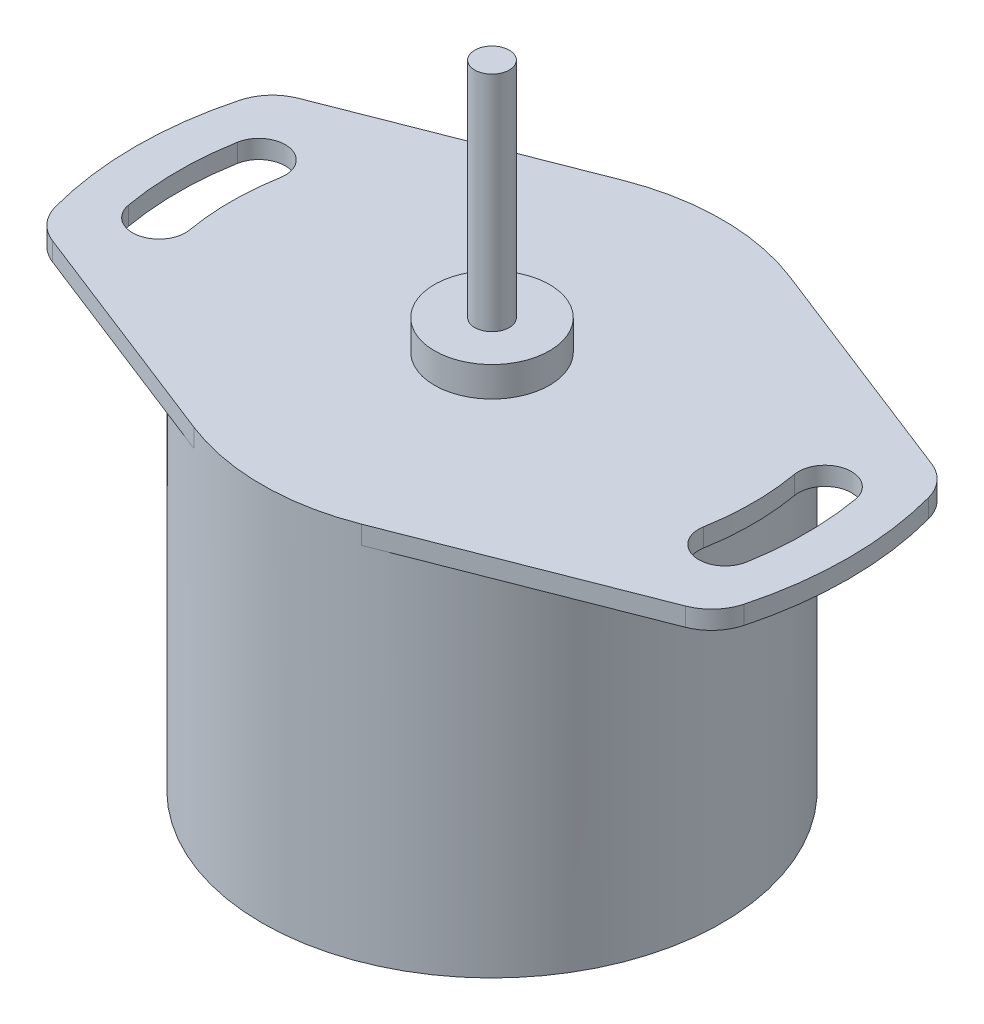
from build123d import *
from build123d.topology import SkipClean

# Parameters (mm, degrees)
SKETCH1_R           = 10
BOSS_EXTRUDE1_DEPTH = 15.7
SKETCH2_R           = 3
BOSS_EXTRUDE2_DEPTH = 1.3
BOSS_EXTRUDE3_DEPTH = 0.8
FILLET1_R           = 2
SKETCH4_R           = 2.5
BOSS_EXTRUDE4_DEPTH = 1.3
SKETCH5_R           = 0.75
BOSS_EXTRUDE5_DEPTH = 9.7
BOSS_EXTRUDE6_START = 1.2
SKETCH6_R           = 0.75
BOSS_EXTRUDE6_DEPTH = 1.2


with BuildPart() as part:
    # Sketch1 → Boss-Extrude1 (new body)
    with BuildSketch(Plane(origin=(0, 0, 0), x_dir=(1, 0, 0), z_dir=(0, 1, 0))):
        with Locations(Location((0, 0, 0), (0, 0, 270))):
            Circle(SKETCH1_R)
    extrude(amount=BOSS_EXTRUDE1_DEPTH)

    # Sketch2 → Boss-Extrude2 (add)
    with BuildSketch(Plane.XZ):
        with Locations(Location((0, 0, 0), (0, 0, 90))):
            Circle(SKETCH2_R)
    extrude(amount=BOSS_EXTRUDE2_DEPTH)

    # Sketch3 → Boss-Extrude3 (add)
    with SkipClean():  # the faces are left unmerged after this step: merging them gives an invalid solid
        with BuildSketch(Plane(origin=(0, 15.7, 0), x_dir=(1, 0, 0), z_dir=(0, 1, 0))):
            with BuildLine():
                Line((-14.671400751, 5), (-3.642056653, 9.313185456))
                ThreePointArc((-3.642056653, 9.313185456), (0, 10), (3.642056653, 9.313185456))
                Line((3.642056653, 9.313185456), (14.671400751, 5))
                ThreePointArc((14.671400751, 5), (15.5, 0), (14.671400751, -5))
                Line((14.671400751, -5), (3.642056653, -9.313185456))
                ThreePointArc((3.642056653, -9.313185456), (0, -10), (-3.642056653, -9.313185456))
                Line((-3.642056653, -9.313185456), (-14.671400751, -5))
                ThreePointArc((-14.671400751, -5), (-15.5, 0), (-14.671400751, 5))
            make_face()
            with BuildLine():
                ThreePointArc((-13.442625829, 2.370297625), (-13.65, 0), (-13.442625829, -2.370297625))
                ThreePointArc((-13.442625829, -2.370297625), (-12.110401508, -3.303131137), (-11.177567997, -1.970906817))
                ThreePointArc((-11.177567997, -1.970906817), (-11.35, 0), (-11.177567997, 1.970906817))
                ThreePointArc((-11.177567997, 1.970906817), (-12.110401508, 3.303131137), (-13.442625829, 2.370297625))
            make_face(mode=Mode.SUBTRACT)
            with BuildLine():
                ThreePointArc((13.442625829, -2.370297625), (13.65, 0), (13.442625829, 2.370297625))
                ThreePointArc((13.442625829, 2.370297625), (12.110401508, 3.303131137), (11.177567997, 1.970906817))
                ThreePointArc((11.177567997, 1.970906817), (11.35, 0), (11.177567997, -1.970906817))
                ThreePointArc((11.177567997, -1.970906817), (12.110401508, -3.303131137), (13.442625829, -2.370297625))
            make_face(mode=Mode.SUBTRACT)
        extrude(amount=BOSS_EXTRUDE3_DEPTH)

    # Fillet1
    fillet1_edges = [part.edges().sort_by_distance(p)[0] for p in [
        (-14.671400751, 16.1, -5),
        (14.671400751, 16.1, -5),
        (14.671400751, 16.1, 5),
        (-14.671400751, 16.1, 5),
    ]]
    fillet(fillet1_edges, radius=FILLET1_R)

    # Sketch4 → Boss-Extrude4 (add)
    with SkipClean():  # the faces are left unmerged after this step: merging them gives an invalid solid
        with BuildSketch(Plane(origin=(0, 16.5, 0), x_dir=(1, 0, 0), z_dir=(0, 1, 0))):
            with Locations(Location((0, 0, 0), (0, 0, 270))):
                Circle(SKETCH4_R)
        extrude(amount=BOSS_EXTRUDE4_DEPTH)

    # Sketch5 → Boss-Extrude5 (add)
    with SkipClean():  # the faces are left unmerged after this step: merging them gives an invalid solid
        with BuildSketch(Plane(origin=(0, 17.8, 0), x_dir=(1, 0, 0), z_dir=(0, 1, 0))):
            with Locations(Location((0, 0, 0), (0, 0, 270))):
                Circle(SKETCH5_R)
        extrude(amount=BOSS_EXTRUDE5_DEPTH)

    # Sketch6 → Boss-Extrude6 (add)
    with SkipClean():  # the faces are left unmerged after this step: merging them gives an invalid solid
        with BuildSketch(Plane.XZ.offset(1.3).offset(BOSS_EXTRUDE6_START)):
            with Locations(Location((0, 0, 0), (0, 0, 90))):
                Circle(SKETCH6_R)
        extrude(amount=-BOSS_EXTRUDE6_DEPTH)


solid = part.part
